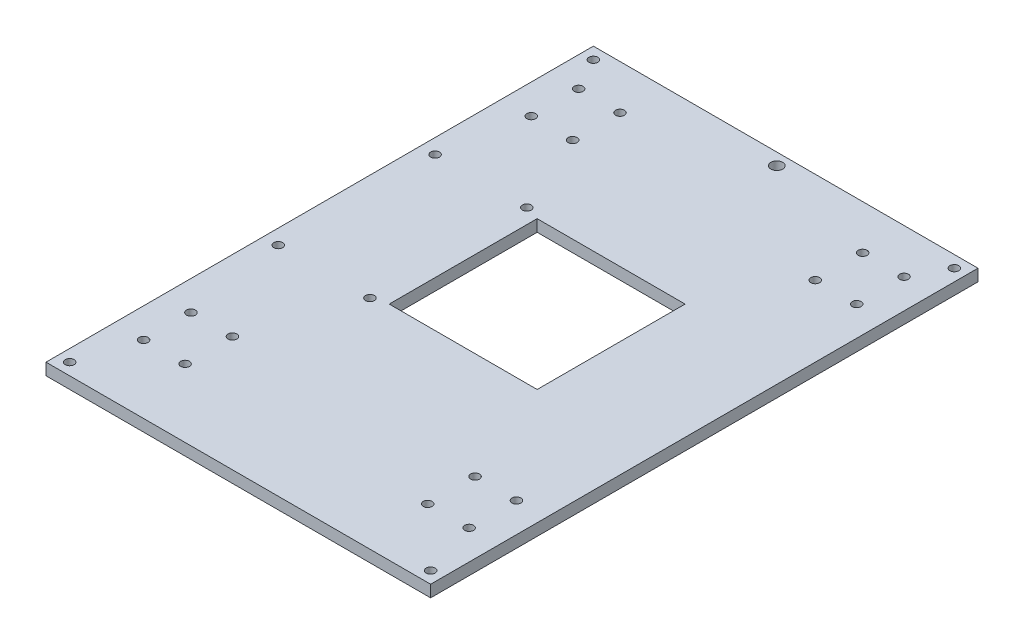
from build123d import *

# Parameters (mm, degrees)
SKETCH1_W           = 130
SKETCH1_H           = 185
SKETCH1_R           = 1.5
BOSS_EXTRUDE1_DEPTH = 4
SKETCH2_W           = 50
SKETCH2_H           = 50
CUT_EXTRUDE1_DEPTH  = 4
SKETCH3_R           = 1.5
CUT_EXTRUDE2_DEPTH  = 49.5
SKETCH4_R           = 2
CUT_EXTRUDE3_DEPTH  = 49.5
SKETCH5_R           = 1.5
CUT_EXTRUDE5_DEPTH  = 10


with BuildPart() as part:
    # Sketch1 → Boss-Extrude1 (new body)
    with BuildSketch(Plane(origin=(0, 0, 0), x_dir=(1, 0, 0), z_dir=(0, 1, 0))):
        with Locations((65, 92.5)):
            Rectangle(SKETCH1_W, SKETCH1_H)
        with Locations(Location((10, 39, 0), (0, 0, 270))):
            Circle(SKETCH1_R, mode=Mode.SUBTRACT)
        with Locations(Location((24, 39, 0), (0, 0, 270))):
            Circle(SKETCH1_R, mode=Mode.SUBTRACT)
        with Locations(Location((10, 23, 0), (0, 0, 270))):
            Circle(SKETCH1_R, mode=Mode.SUBTRACT)
        with Locations(Location((24, 23, 0), (0, 0, 270))):
            Circle(SKETCH1_R, mode=Mode.SUBTRACT)
        with Locations(Location((120, 23, 0), (0, 0, 90))):
            Circle(SKETCH1_R, mode=Mode.SUBTRACT)
        with Locations(Location((120, 39, 0), (0, 0, 90))):
            Circle(SKETCH1_R, mode=Mode.SUBTRACT)
        with Locations(Location((106, 39, 0), (0, 0, 90))):
            Circle(SKETCH1_R, mode=Mode.SUBTRACT)
        with Locations(Location((106, 23, 0), (0, 0, 90))):
            Circle(SKETCH1_R, mode=Mode.SUBTRACT)
        with Locations(Location((106, 170, 0), (0, 0, 270))):
            Circle(SKETCH1_R, mode=Mode.SUBTRACT)
        with Locations(Location((120, 170, 0), (0, 0, 270))):
            Circle(SKETCH1_R, mode=Mode.SUBTRACT)
        with Locations(Location((106, 154, 0), (0, 0, 270))):
            Circle(SKETCH1_R, mode=Mode.SUBTRACT)
        with Locations(Location((120, 154, 0), (0, 0, 270))):
            Circle(SKETCH1_R, mode=Mode.SUBTRACT)
        with Locations(Location((24, 154, 0), (0, 0, 90))):
            Circle(SKETCH1_R, mode=Mode.SUBTRACT)
        with Locations(Location((24, 170, 0), (0, 0, 90))):
            Circle(SKETCH1_R, mode=Mode.SUBTRACT)
        with Locations(Location((10, 170, 0), (0, 0, 90))):
            Circle(SKETCH1_R, mode=Mode.SUBTRACT)
        with Locations(Location((10, 154, 0), (0, 0, 90))):
            Circle(SKETCH1_R, mode=Mode.SUBTRACT)
    extrude(amount=BOSS_EXTRUDE1_DEPTH)

    # Sketch2 → Cut-Extrude1 (cut)
    with BuildSketch(Plane(origin=(0, 4, 0), x_dir=(1, 0, 0), z_dir=(0, 1, 0))):
        with Locations((66, 100)):
            Rectangle(SKETCH2_W, SKETCH2_H)
    extrude(amount=-CUT_EXTRUDE1_DEPTH, mode=Mode.SUBTRACT)

    # Sketch3 → Cut-Extrude2 (cut)
    with BuildSketch(Plane(origin=(0, 4, 0), x_dir=(1, 0, 0), z_dir=(0, 1, 0))):
        with Locations(Location((126, 4, 0), (0, 0, 270))):
            Circle(SKETCH3_R)
        with Locations(Location((126, 181, 0), (0, 0, 90))):
            Circle(SKETCH3_R)
        with Locations(Location((4, 4, 0), (0, 0, 90))):
            Circle(SKETCH3_R)
        with Locations(Location((4, 181, 0), (0, 0, 270))):
            Circle(SKETCH3_R)
    extrude(amount=-CUT_EXTRUDE2_DEPTH, mode=Mode.SUBTRACT)

    # Sketch4 → Cut-Extrude3 (cut)
    with BuildSketch(Plane(origin=(0, 4, 0), x_dir=(1, 0, 0), z_dir=(0, 1, 0))):
        with Locations(Location((66, 181, 0), (0, 0, 90))):
            Circle(SKETCH4_R)
    extrude(amount=-CUT_EXTRUDE3_DEPTH, mode=Mode.SUBTRACT)

    # Sketch5 → Cut-Extrude5 (cut)
    with BuildSketch(Plane(origin=(0, 4, 0), x_dir=(1, 0, 0), z_dir=(0, 1, 0))):
        with Locations(Location((5, 126.5, 0), (0, 0, 270))):
            Circle(SKETCH5_R)
        with Locations(Location((5, 73.5, 0), (0, 0, 90))):
            Circle(SKETCH5_R)
        with Locations(Location((36, 126.5, 0), (0, 0, 90))):
            Circle(SKETCH5_R)
        with Locations(Location((36, 73.5, 0), (0, 0, 270))):
            Circle(SKETCH5_R)
    extrude(amount=-CUT_EXTRUDE5_DEPTH, mode=Mode.SUBTRACT)


solid = part.part
